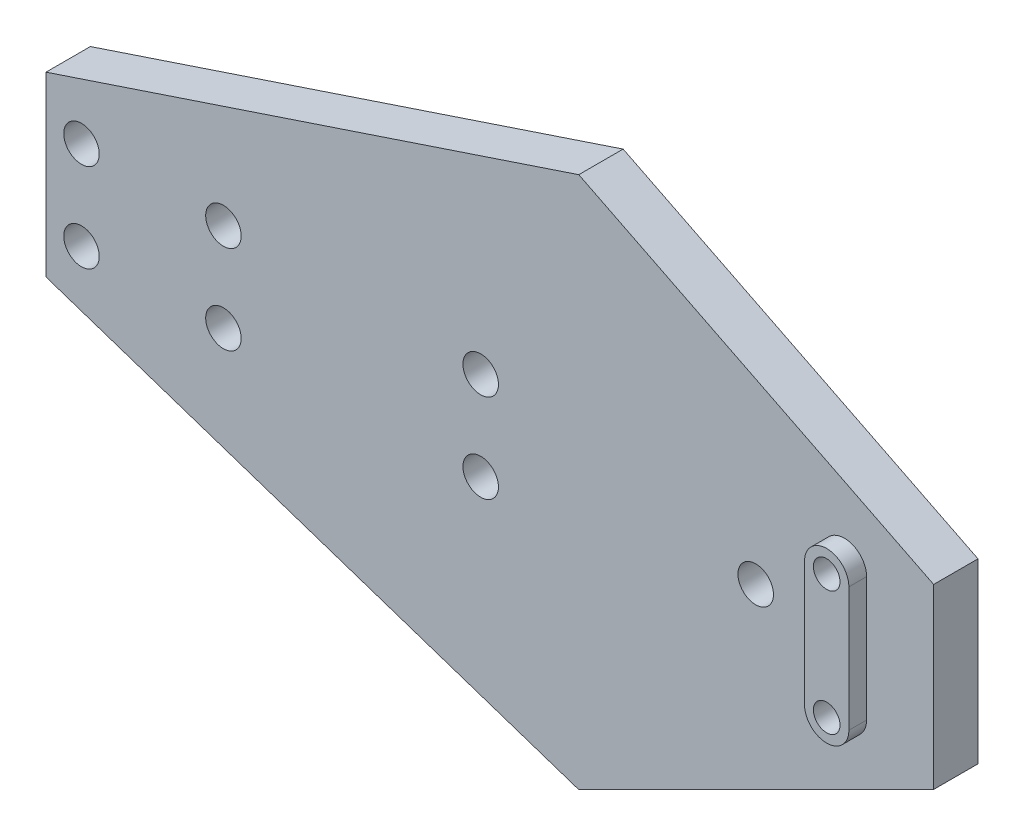
from build123d import *

# Parameters (mm, degrees)
SKETCH_1_R          = 2
SKETCH_1_R_2        = 1.5
EXTRUDE_1_DEPTH     = 2.5
SKETCH_2_R          = 2
CUT_EXTRUDE_1_DEPTH = 2.5
SKETCH_3_R          = 1.5
EXTRUDE_2_DEPTH     = 2


with BuildPart() as part:
    # 草图1 → 凸台-拉伸1 (new, symmetric)
    with BuildSketch(Plane.XY):
        Polygon((0, 0), (60.033704039, -20.01123468), (100.056173399, 0), (100.056173399, 20.015752082), (60.056173399, 40.015752082), (0, 19.997027615), align=None)
        with Locations((20, 5)):
            Circle(SKETCH_1_R, mode=Mode.SUBTRACT)
        with Locations((20, 15)):
            Circle(SKETCH_1_R, mode=Mode.SUBTRACT)
        with Locations((49, 5)):
            Circle(SKETCH_1_R, mode=Mode.SUBTRACT)
        with Locations((49, 15)):
            Circle(SKETCH_1_R, mode=Mode.SUBTRACT)
        with Locations((90, 17)):
            Circle(SKETCH_1_R_2, mode=Mode.SUBTRACT)
        with Locations((90, 3)):
            Circle(SKETCH_1_R_2, mode=Mode.SUBTRACT)
    extrude(amount=EXTRUDE_1_DEPTH, both=True)

    # 草图2 → 切除-拉伸1 (cut, symmetric)
    with BuildSketch(Plane.XY):
        with Locations((80, 10)):
            Circle(SKETCH_2_R)
        with Locations((4, 5)):
            Circle(SKETCH_2_R)
        with Locations((4, 15)):
            Circle(SKETCH_2_R)
    extrude(amount=CUT_EXTRUDE_1_DEPTH, both=True, mode=Mode.SUBTRACT)

    # 草图3 → 凸台-拉伸2 (add)
    with BuildSketch(Plane.XY.offset(2.5)):
        with BuildLine():
            Line((92.5, 17), (92.5, 3))
            ThreePointArc((92.5, 3), (90, 0.5), (87.5, 3))
            Line((87.5, 3), (87.5, 17))
            ThreePointArc((87.5, 17), (90, 19.5), (92.5, 17))
        make_face()
        with Locations((90, 17)):
            Circle(SKETCH_3_R, mode=Mode.SUBTRACT)
        with Locations((90, 3)):
            Circle(SKETCH_3_R, mode=Mode.SUBTRACT)
    extrude(amount=EXTRUDE_2_DEPTH)


solid = part.part
